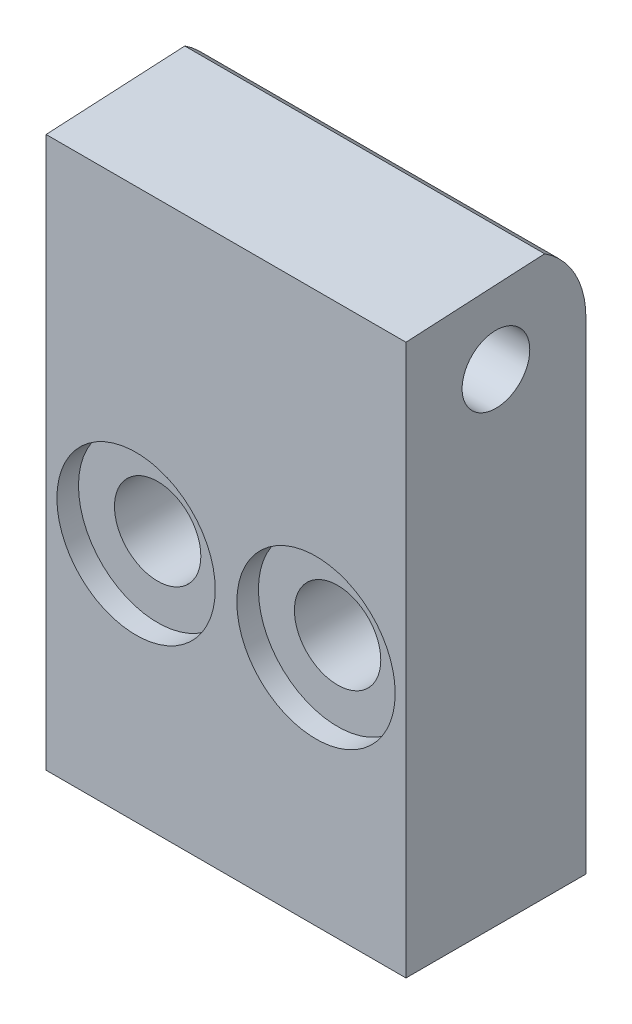
from build123d import *

# Parameters (mm, degrees)
SKETCH1_W           = 12.7
SKETCH1_H           = 20.193
BOSS_EXTRUDE1_DEPTH = 6.35
SKETCH3_R           = 1.524
CUT_EXTRUDE1_DEPTH  = 25.685415715
SKETCH4_R           = 2.794
CUT_EXTRUDE2_DEPTH  = 0.762
SKETCH8_R           = 1.1938
CUT_EXTRUDE5_DEPTH  = 25.685415715
CUT_EXTRUDE7_DEPTH  = 25.685415715
CUT_EXTRUDE8_DEPTH  = 25.685415715


with BuildPart() as part:
    # Sketch1 → Boss-Extrude1 (new body)
    with BuildSketch(Plane.XY):
        with Locations((6.35, 10.0965)):
            Rectangle(SKETCH1_W, SKETCH1_H)
    extrude(amount=BOSS_EXTRUDE1_DEPTH)

    # Sketch3 → Cut-Extrude1 (cut, through all)
    with BuildSketch(Plane.XY.offset(6.35)):
        with Locations((3.175, 8.509)):
            Circle(SKETCH3_R)
        with Locations((9.525, 8.509)):
            Circle(SKETCH3_R)
    extrude(amount=-CUT_EXTRUDE1_DEPTH, mode=Mode.SUBTRACT)

    # Sketch4 → Cut-Extrude2 (cut)
    with BuildSketch(Plane.XY.offset(6.35)):
        with Locations((3.175, 8.509)):
            Circle(SKETCH4_R)
        with Locations((9.525, 8.509)):
            Circle(SKETCH4_R)
    extrude(amount=-CUT_EXTRUDE2_DEPTH, mode=Mode.SUBTRACT)

    # Sketch8 → Cut-Extrude5 (cut, through all)
    with BuildSketch(Plane(origin=(12.7, 0, 0), x_dir=(0, 0, -1), z_dir=(1, 0, 0))):
        with Locations((-3.175, 17.018)):
            Circle(SKETCH8_R)
    extrude(amount=-CUT_EXTRUDE5_DEPTH, mode=Mode.SUBTRACT)

    # Sketch12 → Cut-Extrude7 (cut, through all)
    with BuildSketch(Plane(origin=(12.7, 0, 0), x_dir=(0, 0, -1), z_dir=(1, 0, 0))):
        with BuildLine():
            Line((-6.35, 20.193), (-3.175, 20.193))
            ThreePointArc((-3.175, 20.193), (-0.92993597, 19.26306403), (0, 17.018))
            Line((0, 17.018), (0, 13.936871151))
            Line((0, 13.936871151), (3.924146207, 13.936871151))
            Line((3.924146207, 13.936871151), (3.924146207, 24.495106429))
            Line((3.924146207, 24.495106429), (-6.35, 24.495106429))
            Line((-6.35, 24.495106429), (-6.35, 20.193))
        make_face()
    extrude(amount=-CUT_EXTRUDE7_DEPTH, mode=Mode.SUBTRACT)

    # Sketch13 → Cut-Extrude8 (cut, through all)
    with BuildSketch(Plane(origin=(12.7, 0, 0), x_dir=(0, 0, -1), z_dir=(1, 0, 0))):
        Polygon((-6.35, 19.431), (8.189826156, 20.193), (-6.35, 20.193), align=None)
    extrude(amount=-CUT_EXTRUDE8_DEPTH, mode=Mode.SUBTRACT)


solid = part.part
